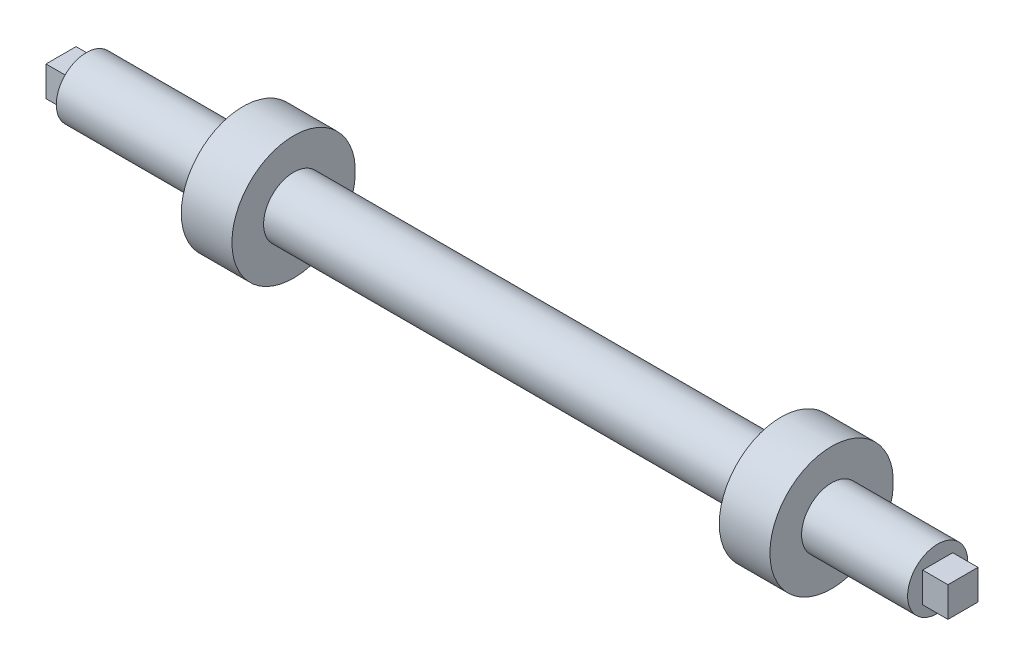
from build123d import *

# Parameters (mm, degrees)
ESQUISSE5_W        = 4.75
ESQUISSE5_H        = 4.75
BOSS_EXTRU_3_DEPTH = 4
BOSS_EXTRU_4_DEPTH = 4


with BuildPart() as part:
    # Esquisse1 → Révolution1 (revolve)
    with BuildSketch(Plane(origin=(0, 0, 0), x_dir=(1, 0, 0), z_dir=(0, 1, 0))):
        Polygon((0, 0), (0, 4.75), (134.5, 4.75), (134.5, 0), (117.75, 0), (117.75, -5), (109.75, -5), (109.75, 0), (32.75, 0), (32.75, -5), (24.75, -5), (24.75, 0), align=None)
    revolve(axis=Axis((0, 0, -4.75), (1, 0, 0)))

    # Esquisse5 → Boss.-Extru.3 (add)
    with BuildSketch(Plane(origin=(134.5, 0, 0), x_dir=(0, 0, -1), z_dir=(1, 0, 0))):
        with Locations((4.75, 0)):
            Rectangle(ESQUISSE5_W, ESQUISSE5_H)
    extrude(amount=BOSS_EXTRU_3_DEPTH)

    # Esquisse6 → Boss.-Extru.4 (add)
    with BuildSketch(Plane.ZY):
        Polygon((-4.75, 2.375), (-7.125, 2.375), (-7.125, -2.375), (-2.375, -2.375), (-2.375, 2.375), align=None)
    extrude(amount=BOSS_EXTRU_4_DEPTH)


solid = part.part
